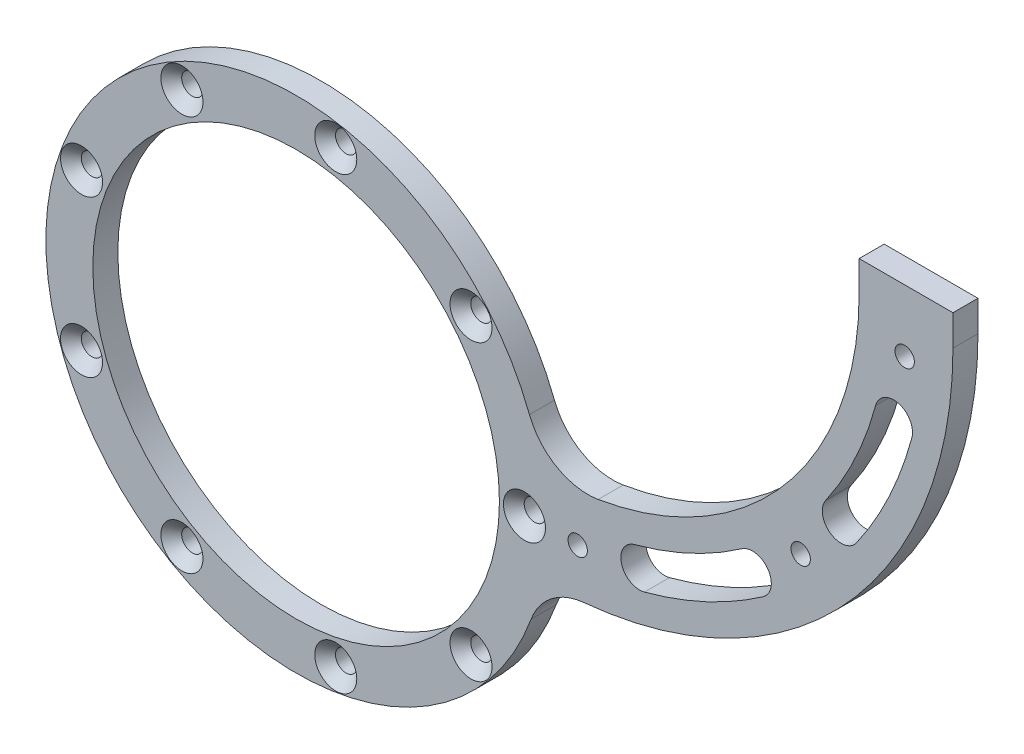
from build123d import *

# Parameters (mm, degrees)
SKETCH_1_R                   = 40
SKETCH_1_R_2                 = 32.5
EXTRUDE_1_DEPTH              = 4
HOLE_WIZARD_M3_1_D           = 3.4
HOLE_WIZARD_M3_1_CSINK_D     = 6.72
HOLE_WIZARD_M3_1_CSINK_ANGLE = 90
EXTRUDE_START                = -4
SKETCH_4_R                   = 1.55
EXTRUDE_2_DEPTH              = 4
FILLET_1_R                   = 10
SKETCH_5_W                   = 15
SKETCH_5_H                   = 4.9
EXTRUDE_3_DEPTH              = 4


with BuildPart() as part:
    # 草图1 → 凸台-拉伸1 (new body)
    with BuildSketch(Plane.XY):
        Circle(SKETCH_1_R)
        Circle(SKETCH_1_R_2, mode=Mode.SUBTRACT)
    extrude(amount=EXTRUDE_1_DEPTH)

    # M3 六角凹锥坑螺钉的锥形沉头孔1 (through all)
    with Locations(Plane.XY.offset(4)):
        with Locations((27.960622174, 23.461747754), (36.5, 0), (27.960622174, -23.461747754), (6.338158485, -35.945482985), (-18.25, -31.609927238), (-34.298780659, -12.483735231), (-34.298780659, 12.483735231), (-18.25, 31.609927238), (6.338158485, 35.945482985)):
            CounterSinkHole(HOLE_WIZARD_M3_1_D / 2, HOLE_WIZARD_M3_1_CSINK_D / 2, counter_sink_angle=HOLE_WIZARD_M3_1_CSINK_ANGLE)

    # 草图4 → 凸台-拉伸2 (add)
    with BuildSketch(Plane.XY.offset(4).offset(EXTRUDE_START)):
        with BuildLine():
            Line((90, 57.5), (105, 57.5))
            ThreePointArc((105, 57.5), (85.710698364, 11.288182733), (39.291321381, -7.496136613))
            ThreePointArc((39.291321381, -7.496136613), (39.999999743, 0.004535468), (39.289620447, 7.505046646))
            ThreePointArc((39.289620447, 7.505046646), (75.103283481, 21.894389644), (90, 57.5))
        make_face()
        with Locations((45.011455208, 0.21880486)):
            Circle(SKETCH_4_R, mode=Mode.SUBTRACT)
        with Locations((80.658639918, 16.841360082)):
            Circle(SKETCH_4_R, mode=Mode.SUBTRACT)
        with Locations((97.28119514, 52.488544792)):
            Circle(SKETCH_4_R, mode=Mode.SUBTRACT)
        with BuildLine():
            ThreePointArc((55.681924073, -0.932245014), (65.568404835, 2.668378884), (74.681550102, 7.927426106))
            ThreePointArc((74.681550102, 7.927426106), (75.419947976, 12.105316552), (71.24205753, 12.843714426))
            ThreePointArc((71.24205753, 12.843714426), (63.032695265, 8.106225607), (54.126691933, 4.862688376))
            ThreePointArc((54.126691933, 4.862688376), (52.006841308, 1.187605611), (55.681924073, -0.932245014))
        make_face(mode=Mode.SUBTRACT)
        with BuildLine():
            ThreePointArc((89.572573894, 22.818449898), (94.831621116, 31.931595165), (98.432245014, 41.818075927))
            ThreePointArc((98.432245014, 41.818075927), (96.312394389, 45.493158692), (92.637311624, 43.373308067))
            ThreePointArc((92.637311624, 43.373308067), (89.393774393, 34.467304735), (84.656285574, 26.25794247))
            ThreePointArc((84.656285574, 26.25794247), (85.394683448, 22.080052024), (89.572573894, 22.818449898))
        make_face(mode=Mode.SUBTRACT)
    extrude(amount=EXTRUDE_2_DEPTH)

    # 圆角1
    fillet_1_edges = [part.edges().sort_by_distance(p)[0] for p in [
        (39.289620447, 7.505046646, 2),
        (39.291321381, -7.496136613, 2),
    ]]
    fillet(fillet_1_edges, radius=FILLET_1_R)

    # 草图5 → 凸台-拉伸3 (add)
    with BuildSketch(Plane.XY.offset(4)):
        with Locations((97.5, 59.95)):
            Rectangle(SKETCH_5_W, SKETCH_5_H)
    extrude(amount=-EXTRUDE_3_DEPTH)


solid = part.part
